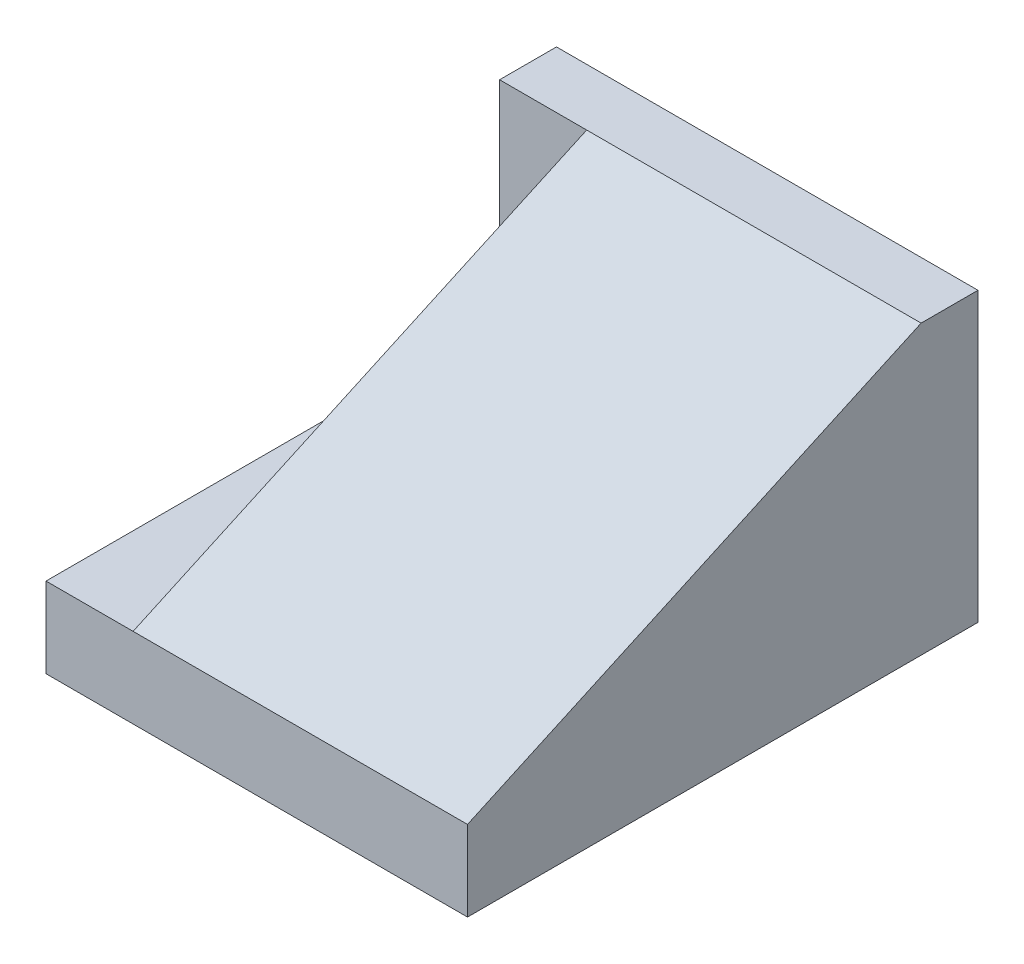
from build123d import *

# Parameters (mm, degrees)
SKETCH1_W           = 126.042151156
SKETCH1_H           = 152.641955782
BOSS_EXTRUDE1_DEPTH = 24
SKETCH2_W           = 126.042151156
SKETCH2_H           = 17.009297173
BOSS_EXTRUDE2_DEPTH = 62
RIB1_REACH          = 172.609
SKETCH3_WALL_W      = 492.350042414
SKETCH3_WALL_H      = 100


with BuildPart() as part:
    # Sketch1 → Boss-Extrude1 (new body)
    with BuildSketch(Plane(origin=(0, 0, 0), x_dir=(1, 0, 0), z_dir=(0, 1, 0))):
        Rectangle(SKETCH1_W, SKETCH1_H)
    extrude(amount=BOSS_EXTRUDE1_DEPTH)

    # Sketch2 → Boss-Extrude2 (add)
    with BuildSketch(Plane(origin=(0, 24, 0), x_dir=(1, 0, 0), z_dir=(0, 1, 0))):
        with Locations((0, 67.816329305)):
            Rectangle(SKETCH2_W, SKETCH2_H)
    extrude(amount=BOSS_EXTRUDE2_DEPTH)

    # Sketch3 wall → Rib1 (add, up to next)
    with BuildSketch(Plane(origin=(63.021075578, 55, 8.504648587), x_dir=(0, -0.415740341777, 0.909483352359), z_dir=(0, -0.909483352359, -0.415740341777)), mode=Mode.PRIVATE) as rib1_sk1:
        with Locations((0, 50)):
            Rectangle(SKETCH3_WALL_W, SKETCH3_WALL_H)
    rib1_tool1 = extrude(rib1_sk1.sketch, amount=RIB1_REACH, mode=Mode.PRIVATE) - part.part
    add(rib1_tool1.solids().sort_by_distance((63.021075578, 55, 8.504648587))[0])


solid = part.part
